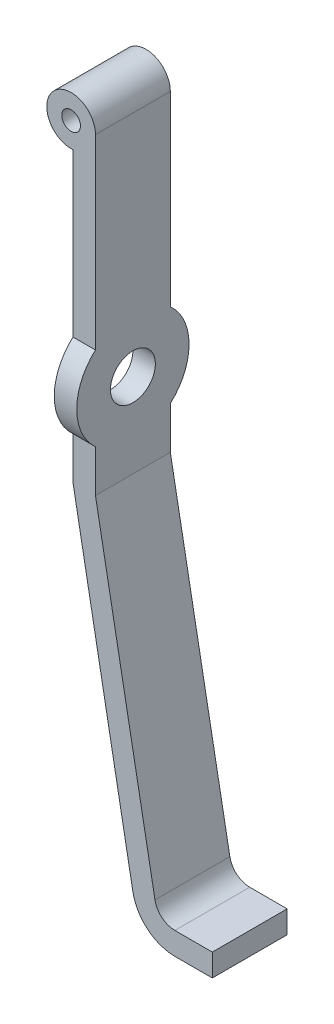
from build123d import *

# Parameters (mm, degrees)
SKETCH1_R           = 1.25
BOSS_EXTRUDE1_DEPTH = 10
CUT_EXTRUDE1_REACH  = 94.193
SKETCH2_R           = 3
SKETCH3_R           = 7.5
SKETCH3_R_2         = 3
BOSS_EXTRUDE2_DEPTH = 3


with BuildPart() as part:
    # Sketch1 → Boss-Extrude1 (new body)
    with BuildSketch(Plane.XY):
        with BuildLine():
            Line((0.25, -3.240370349), (0.25, -41.740370349))
            Line((0.25, -41.740370349), (8.25, -85.075157412))
            ThreePointArc((8.25, -85.075157412), (10.208936196, -88.421482437), (13.855284626, -89.740370349))
            Line((13.855284626, -89.740370349), (18.855284626, -89.740370349))
            Line((18.855284626, -89.740370349), (18.855284626, -86.740370349))
            Line((18.855284626, -86.740370349), (13.855284626, -86.740370349))
            ThreePointArc((13.855284626, -86.740370349), (12.129255683, -86.116622764), (11.200712952, -84.533573379))
            Line((11.200712952, -84.533573379), (3.25, -41.740370349))
            Line((3.25, -41.740370349), (3.25, 0))
            ThreePointArc((3.25, 0), (-2.384848004, 2.207940217), (0.25, -3.240370349))
        make_face()
        Circle(SKETCH1_R, mode=Mode.SUBTRACT)
    extrude(amount=BOSS_EXTRUDE1_DEPTH)

    # Sketch2 → Cut-Extrude1 (cut, up to next)
    with BuildSketch(Plane.ZY.offset(-0.25), mode=Mode.PRIVATE) as cut_extrude1_sk1:
        with Locations(Location((5, -30.5, 0), (0, 0, 270))):
            Circle(SKETCH2_R)
    cut_extrude1_tool1 = extrude(cut_extrude1_sk1.sketch, amount=-CUT_EXTRUDE1_REACH, mode=Mode.PRIVATE) & part.part
    add(cut_extrude1_tool1.solids().sort_by_distance((0.25, -30.5, 5))[0], mode=Mode.SUBTRACT)

    # Sketch3 → Boss-Extrude2 (add)
    with BuildSketch(Plane.ZY.offset(-0.25)):
        with Locations((5, -30.5)):
            Circle(SKETCH3_R)
        with Locations(Location((5, -30.5, 0), (0, 0, 270))):
            Circle(SKETCH3_R_2, mode=Mode.SUBTRACT)
    extrude(amount=-BOSS_EXTRUDE2_DEPTH)


solid = part.part
